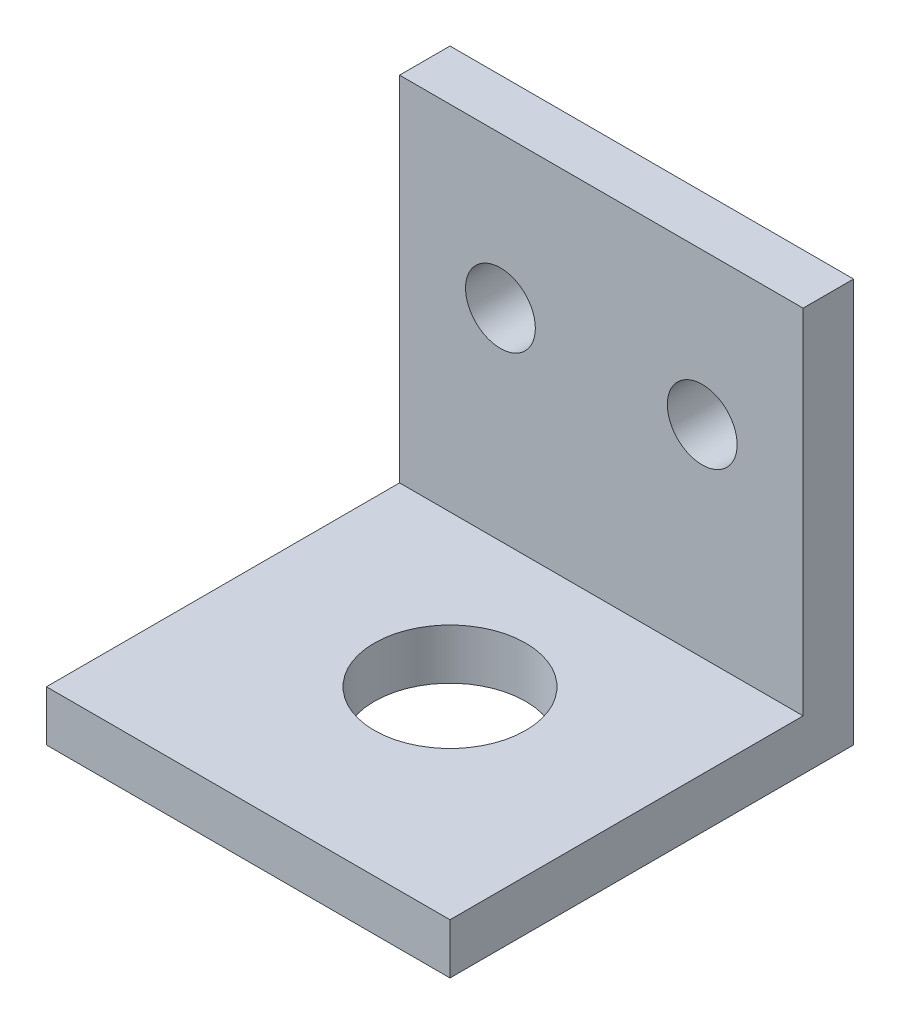
from build123d import *

# Parameters (mm, degrees)
SKETCH1_W           = 25.4
SKETCH1_H           = 25.4
BOSS_EXTRUDE1_DEPTH = 3.175
SKETCH2_W           = 25.4
SKETCH2_H           = 3.175
BOSS_EXTRUDE2_DEPTH = 25.4
SKETCH3_R           = 4.7625
CUT_EXTRUDE1_DEPTH  = 29.575
SKETCH4_R           = 2.1971
CUT_EXTRUDE2_DEPTH  = 37.061067996


with BuildPart() as part:
    # Sketch1 → Boss-Extrude1 (new body)
    with BuildSketch(Plane(origin=(0, 0, 0), x_dir=(1, 0, 0), z_dir=(0, 1, 0))):
        Rectangle(SKETCH1_W, SKETCH1_H)
    extrude(amount=BOSS_EXTRUDE1_DEPTH)

    # Sketch2 → Boss-Extrude2 (add)
    with BuildSketch(Plane.XZ):
        with Locations((0, -11.1125)):
            Rectangle(SKETCH2_W, SKETCH2_H)
    extrude(amount=-BOSS_EXTRUDE2_DEPTH)

    # Sketch3 → Cut-Extrude1 (cut, through all)
    with BuildSketch(Plane(origin=(0, 3.175, 0), x_dir=(1, 0, 0), z_dir=(0, 1, 0))):
        with Locations(Location((0, 0, 0), (0, 0, 270))):
            Circle(SKETCH3_R)
    extrude(amount=-CUT_EXTRUDE1_DEPTH, mode=Mode.SUBTRACT)

    # Sketch4 → Cut-Extrude2 (cut, through all)
    with BuildSketch(Plane.XY.offset(-9.525)):
        with Locations((-6.35, 15.875)):
            Circle(SKETCH4_R)
        with Locations(Location((6.35, 15.875, 0), (0, 0, 180))):
            Circle(SKETCH4_R)
    extrude(amount=-CUT_EXTRUDE2_DEPTH, mode=Mode.SUBTRACT)


solid = part.part
